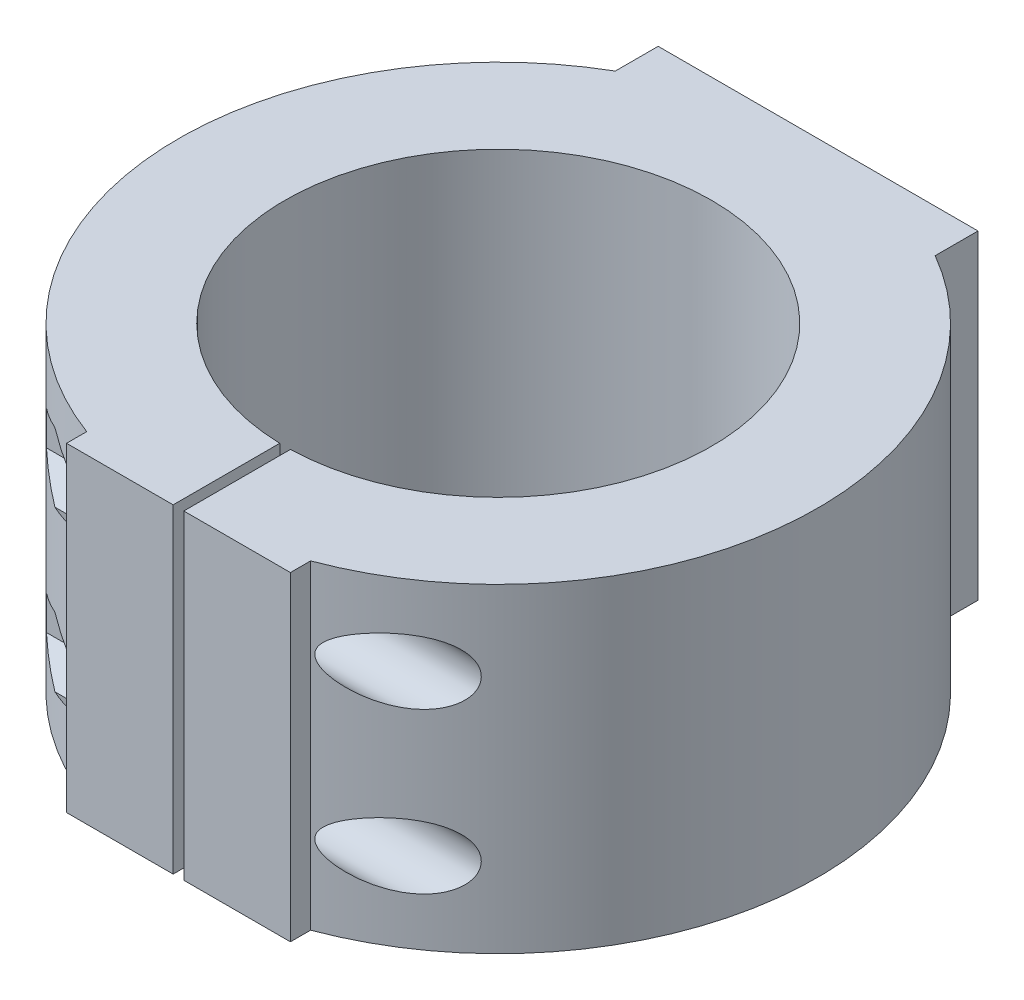
from build123d import *

# Parameters (mm, degrees)
BOSS_EXTRUDE1_DEPTH     = 30
CUT_EXTRUDE1_REACH      = 57
CUT_EXTRUDE1_END_RADIUS = 30
SKETCH7_R               = 3
CUT_EXTRUDE2_REACH      = 57
CUT_EXTRUDE2_END_RADIUS = 30
M3_CLEARANCE_HOLE1_D    = 3.4


with BuildPart() as part:
    # Sketch1 → Boss-Extrude1 (new body)
    with BuildSketch(Plane(origin=(0, 0, 0), x_dir=(1, 0, 0), z_dir=(0, 1, 0))):
        with BuildLine():
            Line((-0.5, -19.993749023), (-0.5, -29.993749023))
            Line((-0.5, -29.993749023), (-10.5, -29.993749023))
            Line((-10.5, -29.993749023), (-10.5, -28.102490993))
            ThreePointArc((-10.5, -28.102490993), (-29.896689894, -2.4875557), (-15, 25.980762114))
            Line((-15, 25.980762114), (-15, 30))
            Line((-15, 30), (15, 30))
            Line((15, 30), (15, 25.980762114))
            ThreePointArc((15, 25.980762114), (29.896689894, -2.4875557), (10.5, -28.102490993))
            Line((10.5, -28.102490993), (10.5, -29.993749023))
            Line((10.5, -29.993749023), (0.5, -29.993749023))
            Line((0.5, -29.993749023), (0.5, -19.993749023))
            ThreePointArc((0.5, -19.993749023), (0, 20), (-0.5, -19.993749023))
        make_face()
    extrude(amount=BOSS_EXTRUDE1_DEPTH)

    # Cut-Extrude1: up to this cylinder (the profile starts inside it)
    cut_extrude1_end = Plane(origin=(0, 15, 0), z_dir=(0, -1, 0)) * Cylinder(CUT_EXTRUDE1_END_RADIUS, 190, mode=Mode.PRIVATE)
    # Sketch7 → Cut-Extrude1 (cut, up to the surface)
    with BuildSketch(Plane(origin=(5, 0, 0), x_dir=(0, 0, -1), z_dir=(1, 0, 0)), mode=Mode.PRIVATE) as cut_extrude1_sk1:
        with Locations(Location((-24.993749023, 22.5, 0), (0, 0, 180))):
            Circle(SKETCH7_R)
    cut_extrude1_tool1 = extrude(cut_extrude1_sk1.sketch, amount=CUT_EXTRUDE1_REACH, mode=Mode.PRIVATE) & cut_extrude1_end
    add(cut_extrude1_tool1.solids().sort_by_distance((5, 22.5, 24.993749))[0], mode=Mode.SUBTRACT)
    # Sketch7 → Cut-Extrude1 (cut, up to the surface)
    with BuildSketch(Plane(origin=(5, 0, 0), x_dir=(0, 0, -1), z_dir=(1, 0, 0)), mode=Mode.PRIVATE) as cut_extrude1_sk2:
        with Locations(Location((-24.993749023, 7.5, 0), (0, 0, 180))):
            Circle(SKETCH7_R)
    cut_extrude1_tool2 = extrude(cut_extrude1_sk2.sketch, amount=CUT_EXTRUDE1_REACH, mode=Mode.PRIVATE) & cut_extrude1_end
    add(cut_extrude1_tool2.solids().sort_by_distance((5, 7.5, 24.993749))[0], mode=Mode.SUBTRACT)

    # Cut-Extrude2: up to this cylinder (the profile starts inside it)
    cut_extrude2_end = Plane(origin=(0, 15, 0), z_dir=(0, -1, 0)) * Cylinder(CUT_EXTRUDE2_END_RADIUS, 190, mode=Mode.PRIVATE)
    # Sketch8 → Cut-Extrude2 (cut, up to the surface)
    with BuildSketch(Plane(origin=(-5, 0, 0), x_dir=(0, 0, -1), z_dir=(1, 0, 0)), mode=Mode.PRIVATE) as cut_extrude2_sk1:
        Polygon((-24.993749023, 19.266838493), (-22.193749023, 20.883419246), (-22.193749023, 24.116580754), (-24.993749023, 25.733161507), (-27.793749023, 24.116580754), (-27.793749023, 20.883419246), align=None)
    cut_extrude2_tool1 = extrude(cut_extrude2_sk1.sketch, amount=-CUT_EXTRUDE2_REACH, mode=Mode.PRIVATE) & cut_extrude2_end
    add(cut_extrude2_tool1.solids().sort_by_distance((-5, 22.5, 24.993749))[0], mode=Mode.SUBTRACT)
    # Sketch8 → Cut-Extrude2 (cut, up to the surface)
    with BuildSketch(Plane(origin=(-5, 0, 0), x_dir=(0, 0, -1), z_dir=(1, 0, 0)), mode=Mode.PRIVATE) as cut_extrude2_sk2:
        Polygon((-24.993749023, 4.266838493), (-22.193749023, 5.883419246), (-22.193749023, 9.116580754), (-24.993749023, 10.733161507), (-27.793749023, 9.116580754), (-27.793749023, 5.883419246), align=None)
    cut_extrude2_tool2 = extrude(cut_extrude2_sk2.sketch, amount=-CUT_EXTRUDE2_REACH, mode=Mode.PRIVATE) & cut_extrude2_end
    add(cut_extrude2_tool2.solids().sort_by_distance((-5, 7.5, 24.993749))[0], mode=Mode.SUBTRACT)

    # M3 Clearance Hole1 (through all)
    with Locations(Plane(origin=(5, 0, 0), x_dir=(0, 0, -1), z_dir=(1, 0, 0))):
        with Locations((-24.993749023, 7.5), (-24.993749023, 22.5)):
            Hole(M3_CLEARANCE_HOLE1_D / 2)


solid = part.part
